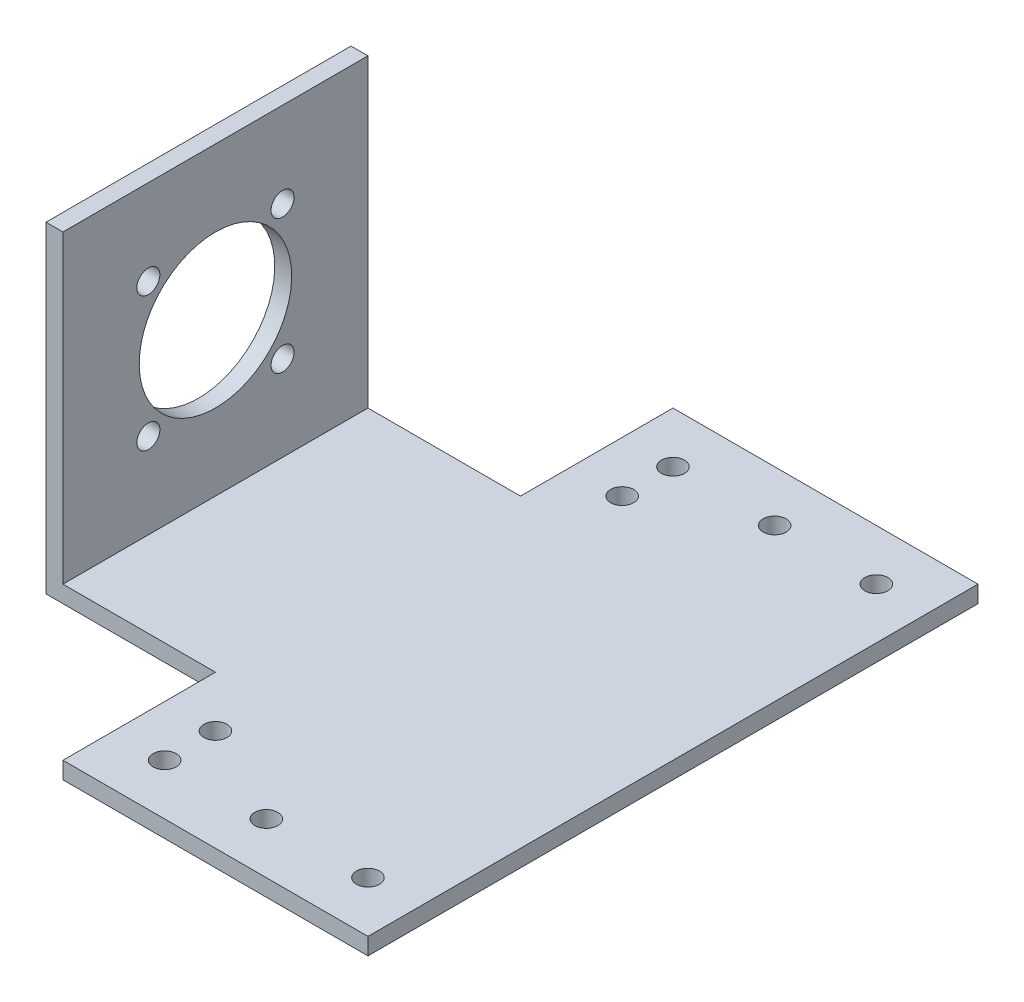
from build123d import *

# Parameters (mm, degrees)
SKIZZE1_W                       = 45
SKIZZE1_H                       = 2.5
AUFSATZ_LINEAR_AUSTRAGEN1_DEPTH = 45
AUFSATZ_LINEAR_AUSTRAGEN2_DEPTH = 22.5
SKIZZE3_R                       = 11.25
SCHNITT_LINEAR_AUSTRAGEN1_DEPTH = 95.007978385
SKIZZE4_R                       = 1.7
SCHNITT_LINEAR_AUSTRAGEN2_DEPTH = 95.007978385
SKIZZE5_R                       = 1.7
SCHNITT_LINEAR_AUSTRAGEN3_DEPTH = 78.942286341


with BuildPart() as part:
    # Skizze1 → Aufsatz-Linear austragen1 (new, symmetric)
    with BuildSketch(Plane.XY):
        with Locations((22.5, 1.25)):
            Rectangle(SKIZZE1_W, SKIZZE1_H)
    extrude(amount=AUFSATZ_LINEAR_AUSTRAGEN1_DEPTH, both=True)

    # Skizze2 → Aufsatz-Linear austragen2 (add, symmetric)
    with BuildSketch(Plane.XY):
        Polygon((0, 0), (-25, 0), (-25, 47.5), (-22.5, 47.5), (-22.5, 2.5), (0, 2.5), align=None)
    extrude(amount=AUFSATZ_LINEAR_AUSTRAGEN2_DEPTH, both=True)

    # Skizze3 → Schnitt-Linear austragen1 (cut, through all)
    with BuildSketch(Plane(origin=(-22.5, 0, 0), x_dir=(0, 0, -1), z_dir=(1, 0, 0))):
        with Locations(Location((0, 25, 0), (0, 0, 90))):
            Circle(SKIZZE3_R)
    extrude(amount=-SCHNITT_LINEAR_AUSTRAGEN1_DEPTH, mode=Mode.SUBTRACT)

    # Skizze4 → Schnitt-Linear austragen2 (cut, through all)
    with BuildSketch(Plane(origin=(-22.5, 0, 0), x_dir=(0, 0, -1), z_dir=(1, 0, 0))):
        with Locations(Location((-9.899494937, 34.899494937, 0), (0, 0, 90))):
            Circle(SKIZZE4_R)
        with Locations(Location((9.899494937, 34.899494937, 0), (0, 0, 270))):
            Circle(SKIZZE4_R)
        with Locations(Location((-9.899494937, 15.100505063, 0), (0, 0, 270))):
            Circle(SKIZZE4_R)
        with Locations(Location((9.899494937, 15.100505063, 0), (0, 0, 90))):
            Circle(SKIZZE4_R)
    extrude(amount=-SCHNITT_LINEAR_AUSTRAGEN2_DEPTH, mode=Mode.SUBTRACT)

    # Skizze5 → Schnitt-Linear austragen3 (cut, through all)
    with BuildSketch(Plane(origin=(0, 2.5, 0), x_dir=(1, 0, 0), z_dir=(0, 1, 0))):
        with Locations(Location((7.5, 37.5, 0), (0, 0, 180))):
            Circle(SKIZZE5_R)
        with Locations(Location((7.5, 30, 0), (0, 0, 180))):
            Circle(SKIZZE5_R)
        with Locations(Location((22.5, 37.5, 0), (0, 0, 180))):
            Circle(SKIZZE5_R)
        with Locations(Location((37.5, 37.5, 0), (0, 0, 180))):
            Circle(SKIZZE5_R)
        with Locations((7.5, -30)):
            Circle(SKIZZE5_R)
        with Locations((37.5, -37.5)):
            Circle(SKIZZE5_R)
        with Locations((22.5, -37.5)):
            Circle(SKIZZE5_R)
        with Locations((7.5, -37.5)):
            Circle(SKIZZE5_R)
    extrude(amount=-SCHNITT_LINEAR_AUSTRAGEN3_DEPTH, mode=Mode.SUBTRACT)


solid = part.part
